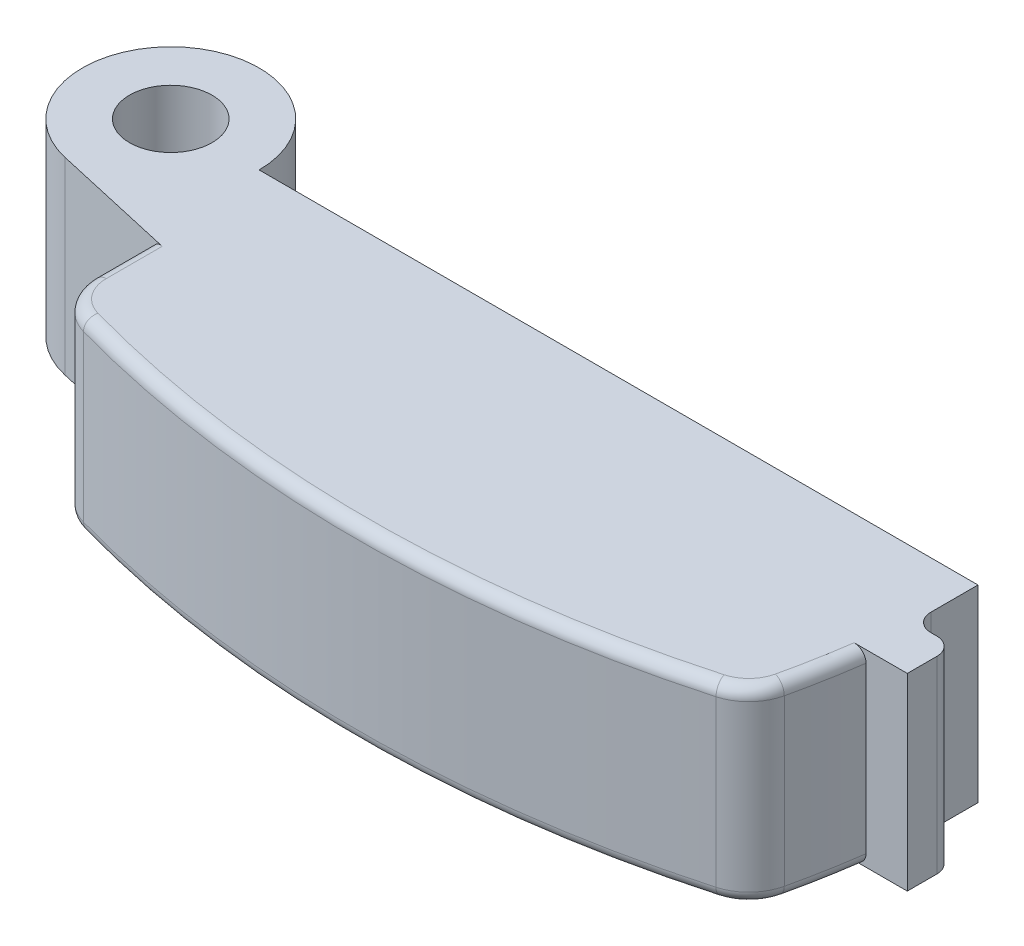
from build123d import *

# Parameters (mm, degrees)
SKETCH1_R           = 1.75
BOSS_EXTRUDE1_DEPTH = 4
SKETCH3_W           = 1.75
SKETCH3_H           = 8
BOSS_EXTRUDE2_DEPTH = 2
FILLET1_R           = 0.5
SKETCH4_W           = 4
SKETCH4_H           = 5
CUT_EXTRUDE1_DEPTH  = 4
FILLET2_R           = 0.75


with BuildPart() as part:
    # Sketch1 → Boss-Extrude1 (new, symmetric)
    with BuildSketch(Plane(origin=(0, 0, 0), x_dir=(1, 0, 0), z_dir=(0, 1, 0))):
        with BuildLine():
            Line((34.25, 0), (3.75, 0))
            ThreePointArc((3.75, 0), (-2.34080149, 2.929701074), (-0.827679139, -3.657519275))
            Line((-0.827679139, -3.657519275), (4, -4.75))
            Line((4, -4.75), (4, -7.239192993))
            ThreePointArc((4, -7.239192993), (4.407286712, -8.448847647), (5.463264382, -9.165826034))
            ThreePointArc((5.463264382, -9.165826034), (18.881654838, -11), (32.300045295, -9.165826034))
            ThreePointArc((32.300045295, -9.165826034), (33.210788376, -8.619339874), (33.713306247, -7.68361776))
            ThreePointArc((33.713306247, -7.68361776), (34.013295596, -6.222597745), (34.25, -4.75))
            Line((34.25, -4.75), (34.25, 0))
        make_face()
        Circle(SKETCH1_R, mode=Mode.SUBTRACT)
    extrude(amount=BOSS_EXTRUDE1_DEPTH, both=True)

    # Sketch3 → Boss-Extrude2 (add)
    with BuildSketch(Plane(origin=(0, 0, 4.75), x_dir=(-1, 0, 0), z_dir=(0, 0, -1))):
        with Locations((-35.125, 0)):
            Rectangle(SKETCH3_W, SKETCH3_H)
    extrude(amount=BOSS_EXTRUDE2_DEPTH)

    # Fillet1
    fillet1_edges = [part.edges().sort_by_distance(p)[0] for p in [
        (4, 4, 5.994596496),
        (4, -4, 5.994596496),
        (4.407286712, -4, 8.448847647),
        (18.881654838, -4, 11),
        (33.210788376, -4, 8.619339874),
        (34.013295596, -4, 6.222597745),
        (34.013295596, 4, 6.222597745),
        (33.210788376, 4, 8.619339874),
        (18.881654838, 4, 11),
        (4.407286712, 4, 8.448847647),
    ]]
    fillet(fillet1_edges, radius=FILLET1_R)

    # Sketch4 → Cut-Extrude1 (cut)
    with BuildSketch(Plane(origin=(0, 0, 0), x_dir=(-1, 0, 0), z_dir=(0, 0, -1))):
        with Locations((-30, 0)):
            Rectangle(SKETCH4_W, SKETCH4_H)
    extrude(amount=-CUT_EXTRUDE1_DEPTH, mode=Mode.SUBTRACT)

    # Fillet2
    fillet2_edges = [part.edges().sort_by_distance(p)[0] for p in [
        (34.25, 0, 2.75),
        (36, 0, 2.75),
    ]]
    fillet(fillet2_edges, radius=FILLET2_R)


solid = part.part
